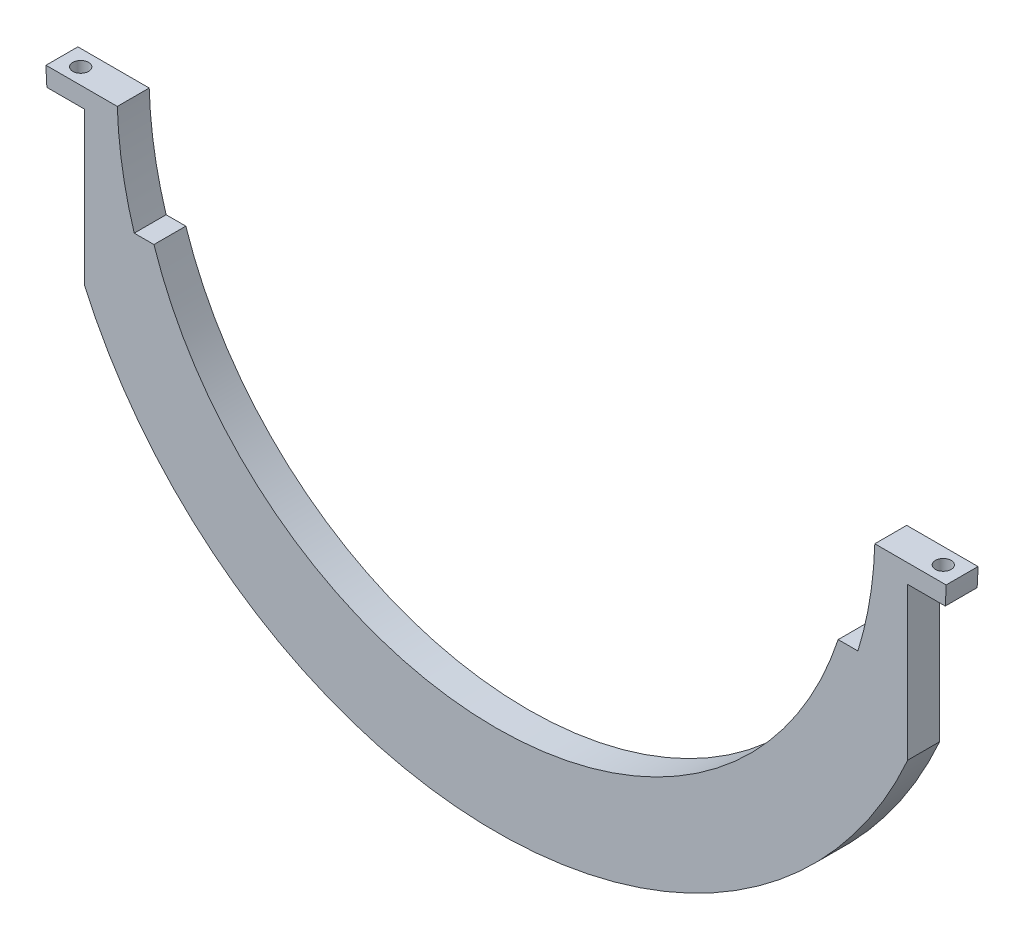
from build123d import *

# Parameters (mm, degrees)
EXTRUDE_1_DEPTH     = 8.5
SKETCH_2_R          = 2.1
CUT_EXTRUDE_1_DEPTH = 10


with BuildPart() as part:
    # 草图1 → 凸台-拉伸1 (new body)
    with BuildSketch(Plane.XY):
        with BuildLine():
            Line((-119.733036377, -8), (-109.733036377, -8))
            Line((-109.733036377, -8), (-109.733036377, -48.566045006))
            ThreePointArc((-109.733036377, -48.566045006), (0, -120), (109.733036377, -48.566045006))
            Line((109.733036377, -48.566045006), (109.733036377, -8))
            Line((109.733036377, -8), (119.733036377, -8))
            ThreePointArc((119.733036377, -8), (119.873837168, -5.50119648), (119.962494139, -3))
            Line((119.962494139, -3), (100.955435713, -3))
            ThreePointArc((100.955435713, -3), (99.617551315, -16.653632338), (96.441692229, -30))
            Line((96.441692229, -30), (91.192104921, -30))
            ThreePointArc((91.192104921, -30), (0, -96), (-91.192104921, -30))
            Line((-91.192104921, -30), (-96.441692229, -30))
            ThreePointArc((-96.441692229, -30), (-99.617551315, -16.653632338), (-100.955435713, -3))
            Line((-100.955435713, -3), (-119.962494139, -3))
            ThreePointArc((-119.962494139, -3), (-119.873837168, -5.50119648), (-119.733036377, -8))
        make_face()
    extrude(amount=EXTRUDE_1_DEPTH)

    # 草图2 → 切除-拉伸1 (cut)
    with BuildSketch(Plane(origin=(0, -3, 0), x_dir=(1, 0, 0), z_dir=(0, 1, 0))):
        with Locations(Location((-114.962494139, -4.25, 0), (0, 0, 270))):
            Circle(SKETCH_2_R)
        with Locations(Location((114.962494139, -4.25, 0), (0, 0, 270))):
            Circle(SKETCH_2_R)
    extrude(amount=-CUT_EXTRUDE_1_DEPTH, mode=Mode.SUBTRACT)


solid = part.part
